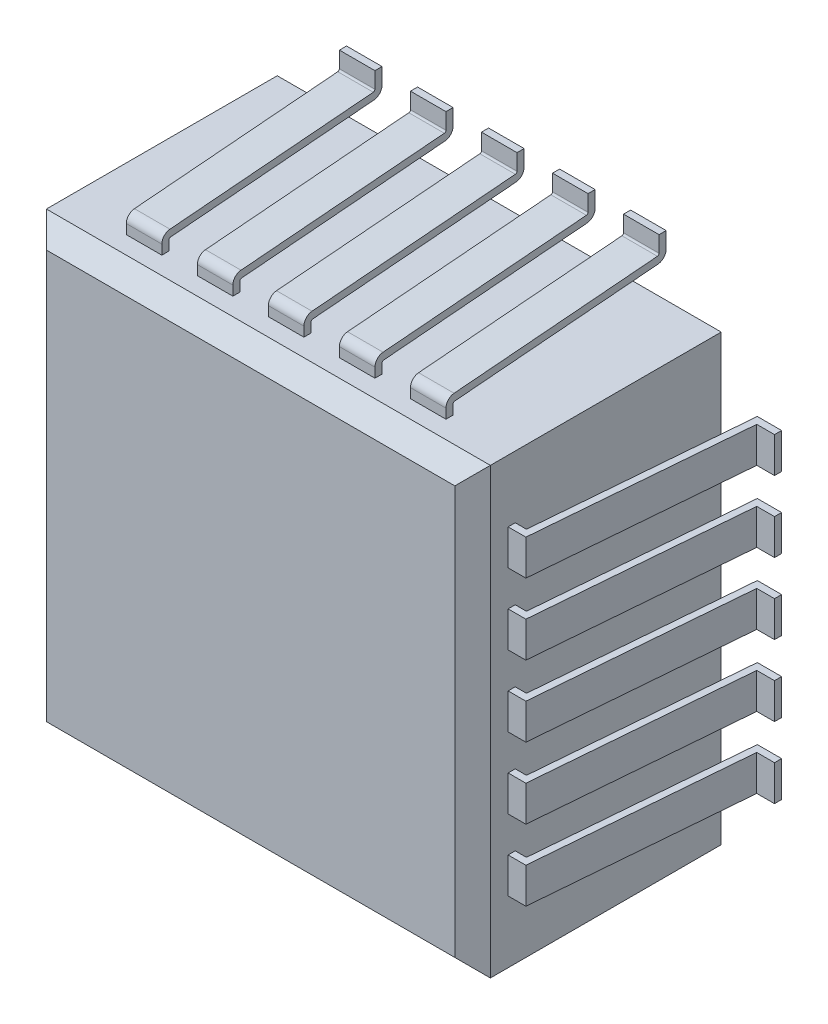
from build123d import *

# Parameters (mm, degrees)
COMPONENT_OUTLINE_W  = 2.5
COMPONENT_OUTLINE_H  = 2.5
EXTRUDE1_DEPTH       = 1.4
EXTRUDE_THIN1_DEPTH  = 0.1
LPATTERN1_COUNT      = 3
LPATTERN1_PITCH      = 0.4
LPATTERN1_COL_COUNT  = 3
LPATTERN1_COL_PITCH  = 0.4
MIRROR1_COPY_1_DEPTH = 0.1
MIRROR1_COPY_2_DEPTH = 0.1
MIRROR1_COPY_3_DEPTH = 0.1
MIRROR1_COPY_4_DEPTH = 0.1
EXTRUDE_THIN2_DEPTH  = 0.1
LPATTERN2_COUNT      = 3
LPATTERN2_PITCH      = 0.4
LPATTERN2_COL_COUNT  = 3
LPATTERN2_COL_PITCH  = 0.4
MIRROR2_COPY_1_DEPTH = 0.1
MIRROR2_COPY_2_DEPTH = 0.1
MIRROR2_COPY_3_DEPTH = 0.1
MIRROR2_COPY_4_DEPTH = 0.1
CHAMFER1_SIZE        = 0.1


with BuildPart() as part:
    # COMPONENT_OUTLINE → Extrude1 (new body)
    with BuildSketch(Plane.XY):
        Rectangle(COMPONENT_OUTLINE_W, COMPONENT_OUTLINE_H)
    extrude(amount=EXTRUDE1_DEPTH)

    # Sketch1 → Extrude-Thin1 (add, symmetric)
    with BuildSketch(Plane(origin=(0, 0, 0), x_dir=(0, 0, -1), z_dir=(1, 0, 0))):
        with BuildLine():
            Line((-1.2, 1.25), (-1.2, 1.303993356))
            ThreePointArc((-1.2, 1.303993356), (-1.186794114, 1.33784883), (-1.154152274, 1.353820644))
            Line((-1.154152274, 1.353820644), (-0.009169545, 1.449235871))
            ThreePointArc((-0.009169545, 1.449235871), (-0.002641177, 1.452430234), (0, 1.459201329))
            Line((0, 1.459201329), (0, 1.55))
            Line((0, 1.55), (0.04, 1.55))
            Line((0.04, 1.55), (0.04, 1.459201329))
            ThreePointArc((0.04, 1.459201329), (0.026794114, 1.425345854), (-0.005847726, 1.409374041))
            Line((-0.005847726, 1.409374041), (-1.150830455, 1.313958814))
            ThreePointArc((-1.150830455, 1.313958814), (-1.157358823, 1.310764451), (-1.16, 1.303993356))
            Line((-1.16, 1.303993356), (-1.16, 1.25))
            Line((-1.16, 1.25), (-1.2, 1.25))
        make_face()
    extrude_thin1 = extrude(amount=EXTRUDE_THIN1_DEPTH, both=True)

    # LPattern1: Extrude-Thin1 ×3
    with Locations(*[(-i * LPATTERN1_PITCH, 0, 0) for i in range(1, LPATTERN1_COUNT)]):
        add(extrude_thin1)

    # LPattern1 col: Extrude-Thin1 ×3
    with Locations(*[(i * LPATTERN1_COL_PITCH, 0, 0) for i in range(1, LPATTERN1_COL_COUNT)]):
        add(extrude_thin1)

    # Mirror1: Extrude-Thin1 across plane
    add(extrude_thin1.mirror(Plane.ZX))

    # Mirror1 copy 1 sketch → Mirror1 copy 1 (add, symmetric)
    with BuildSketch(Plane(origin=(-0.4, 0, 0), x_dir=(0, 0, -1), z_dir=(1, 0, 0))):
        with BuildLine():
            Line((-1.2, -1.25), (-1.2, -1.303993356))
            ThreePointArc((-1.2, -1.303993356), (-1.186794114, -1.33784883), (-1.154152274, -1.353820644))
            Line((-1.154152274, -1.353820644), (-0.009169545, -1.449235871))
            ThreePointArc((-0.009169545, -1.449235871), (-0.002641177, -1.452430234), (0, -1.459201329))
            Line((0, -1.459201329), (0, -1.55))
            Line((0, -1.55), (0.04, -1.55))
            Line((0.04, -1.55), (0.04, -1.459201329))
            ThreePointArc((0.04, -1.459201329), (0.026794114, -1.425345854), (-0.005847726, -1.409374041))
            Line((-0.005847726, -1.409374041), (-1.150830455, -1.313958814))
            ThreePointArc((-1.150830455, -1.313958814), (-1.157358823, -1.310764451), (-1.16, -1.303993356))
            Line((-1.16, -1.303993356), (-1.16, -1.25))
            Line((-1.16, -1.25), (-1.2, -1.25))
        make_face()
    extrude(amount=MIRROR1_COPY_1_DEPTH, both=True)

    # Mirror1 copy 2 sketch → Mirror1 copy 2 (add, symmetric)
    with BuildSketch(Plane(origin=(-0.8, 0, 0), x_dir=(0, 0, -1), z_dir=(1, 0, 0))):
        with BuildLine():
            Line((-1.2, -1.25), (-1.2, -1.303993356))
            ThreePointArc((-1.2, -1.303993356), (-1.186794114, -1.33784883), (-1.154152274, -1.353820644))
            Line((-1.154152274, -1.353820644), (-0.009169545, -1.449235871))
            ThreePointArc((-0.009169545, -1.449235871), (-0.002641177, -1.452430234), (0, -1.459201329))
            Line((0, -1.459201329), (0, -1.55))
            Line((0, -1.55), (0.04, -1.55))
            Line((0.04, -1.55), (0.04, -1.459201329))
            ThreePointArc((0.04, -1.459201329), (0.026794114, -1.425345854), (-0.005847726, -1.409374041))
            Line((-0.005847726, -1.409374041), (-1.150830455, -1.313958814))
            ThreePointArc((-1.150830455, -1.313958814), (-1.157358823, -1.310764451), (-1.16, -1.303993356))
            Line((-1.16, -1.303993356), (-1.16, -1.25))
            Line((-1.16, -1.25), (-1.2, -1.25))
        make_face()
    extrude(amount=MIRROR1_COPY_2_DEPTH, both=True)

    # Mirror1 copy 3 sketch → Mirror1 copy 3 (add, symmetric)
    with BuildSketch(Plane(origin=(0.4, 0, 0), x_dir=(0, 0, -1), z_dir=(1, 0, 0))):
        with BuildLine():
            Line((-1.2, -1.25), (-1.2, -1.303993356))
            ThreePointArc((-1.2, -1.303993356), (-1.186794114, -1.33784883), (-1.154152274, -1.353820644))
            Line((-1.154152274, -1.353820644), (-0.009169545, -1.449235871))
            ThreePointArc((-0.009169545, -1.449235871), (-0.002641177, -1.452430234), (0, -1.459201329))
            Line((0, -1.459201329), (0, -1.55))
            Line((0, -1.55), (0.04, -1.55))
            Line((0.04, -1.55), (0.04, -1.459201329))
            ThreePointArc((0.04, -1.459201329), (0.026794114, -1.425345854), (-0.005847726, -1.409374041))
            Line((-0.005847726, -1.409374041), (-1.150830455, -1.313958814))
            ThreePointArc((-1.150830455, -1.313958814), (-1.157358823, -1.310764451), (-1.16, -1.303993356))
            Line((-1.16, -1.303993356), (-1.16, -1.25))
            Line((-1.16, -1.25), (-1.2, -1.25))
        make_face()
    extrude(amount=MIRROR1_COPY_3_DEPTH, both=True)

    # Mirror1 copy 4 sketch → Mirror1 copy 4 (add, symmetric)
    with BuildSketch(Plane(origin=(0.8, 0, 0), x_dir=(0, 0, -1), z_dir=(1, 0, 0))):
        with BuildLine():
            Line((-1.2, -1.25), (-1.2, -1.303993356))
            ThreePointArc((-1.2, -1.303993356), (-1.186794114, -1.33784883), (-1.154152274, -1.353820644))
            Line((-1.154152274, -1.353820644), (-0.009169545, -1.449235871))
            ThreePointArc((-0.009169545, -1.449235871), (-0.002641177, -1.452430234), (0, -1.459201329))
            Line((0, -1.459201329), (0, -1.55))
            Line((0, -1.55), (0.04, -1.55))
            Line((0.04, -1.55), (0.04, -1.459201329))
            ThreePointArc((0.04, -1.459201329), (0.026794114, -1.425345854), (-0.005847726, -1.409374041))
            Line((-0.005847726, -1.409374041), (-1.150830455, -1.313958814))
            ThreePointArc((-1.150830455, -1.313958814), (-1.157358823, -1.310764451), (-1.16, -1.303993356))
            Line((-1.16, -1.303993356), (-1.16, -1.25))
            Line((-1.16, -1.25), (-1.2, -1.25))
        make_face()
    extrude(amount=MIRROR1_COPY_4_DEPTH, both=True)

    # Sketch2 → Extrude-Thin2 (add, symmetric)
    with BuildSketch(Plane(origin=(0, 0, 0), x_dir=(1, 0, 0), z_dir=(0, 1, 0))):
        Polygon((1.25, -1.2), (1.35, -1.2), (1.45, 0), (1.55, 0), (1.55, 0.04), (1.413194685, 0.04), (1.313194685, -1.16), (1.25, -1.16), align=None)
    extrude_thin2 = extrude(amount=EXTRUDE_THIN2_DEPTH, both=True)

    # LPattern2: Extrude-Thin2 ×3
    with Locations(*[(0, i * LPATTERN2_PITCH, 0) for i in range(1, LPATTERN2_COUNT)]):
        add(extrude_thin2)

    # LPattern2 col: Extrude-Thin2 ×3
    with Locations(*[(0, -i * LPATTERN2_COL_PITCH, 0) for i in range(1, LPATTERN2_COL_COUNT)]):
        add(extrude_thin2)

    # Mirror2: Extrude-Thin2 across plane
    add(extrude_thin2.mirror(Plane(origin=(0, 0, 0), x_dir=(0, 0, 1), z_dir=(1, 0, 0))))

    # Mirror2 copy 1 sketch → Mirror2 copy 1 (add, symmetric)
    with BuildSketch(Plane(origin=(0, 0.4, 0), x_dir=(-1, 0, 0), z_dir=(0, 1, 0))):
        Polygon((1.25, 1.2), (1.35, 1.2), (1.45, 0), (1.55, 0), (1.55, -0.04), (1.413194685, -0.04), (1.313194685, 1.16), (1.25, 1.16), align=None)
    extrude(amount=MIRROR2_COPY_1_DEPTH, both=True)

    # Mirror2 copy 2 sketch → Mirror2 copy 2 (add, symmetric)
    with BuildSketch(Plane(origin=(0, 0.8, 0), x_dir=(-1, 0, 0), z_dir=(0, 1, 0))):
        Polygon((1.25, 1.2), (1.35, 1.2), (1.45, 0), (1.55, 0), (1.55, -0.04), (1.413194685, -0.04), (1.313194685, 1.16), (1.25, 1.16), align=None)
    extrude(amount=MIRROR2_COPY_2_DEPTH, both=True)

    # Mirror2 copy 3 sketch → Mirror2 copy 3 (add, symmetric)
    with BuildSketch(Plane(origin=(0, -0.4, 0), x_dir=(-1, 0, 0), z_dir=(0, 1, 0))):
        Polygon((1.25, 1.2), (1.35, 1.2), (1.45, 0), (1.55, 0), (1.55, -0.04), (1.413194685, -0.04), (1.313194685, 1.16), (1.25, 1.16), align=None)
    extrude(amount=MIRROR2_COPY_3_DEPTH, both=True)

    # Mirror2 copy 4 sketch → Mirror2 copy 4 (add, symmetric)
    with BuildSketch(Plane(origin=(0, -0.8, 0), x_dir=(-1, 0, 0), z_dir=(0, 1, 0))):
        Polygon((1.25, 1.2), (1.35, 1.2), (1.45, 0), (1.55, 0), (1.55, -0.04), (1.413194685, -0.04), (1.313194685, 1.16), (1.25, 1.16), align=None)
    extrude(amount=MIRROR2_COPY_4_DEPTH, both=True)

    # Chamfer1
    chamfer1_edges = [part.edges().sort_by_distance(p)[0] for p in [
        (0, -1.25, 1.4),
        (1.25, 0, 1.4),
        (0, 1.25, 1.4),
        (-1.25, 0, 1.4),
    ]]
    chamfer(chamfer1_edges, length=CHAMFER1_SIZE)


solid = part.part
